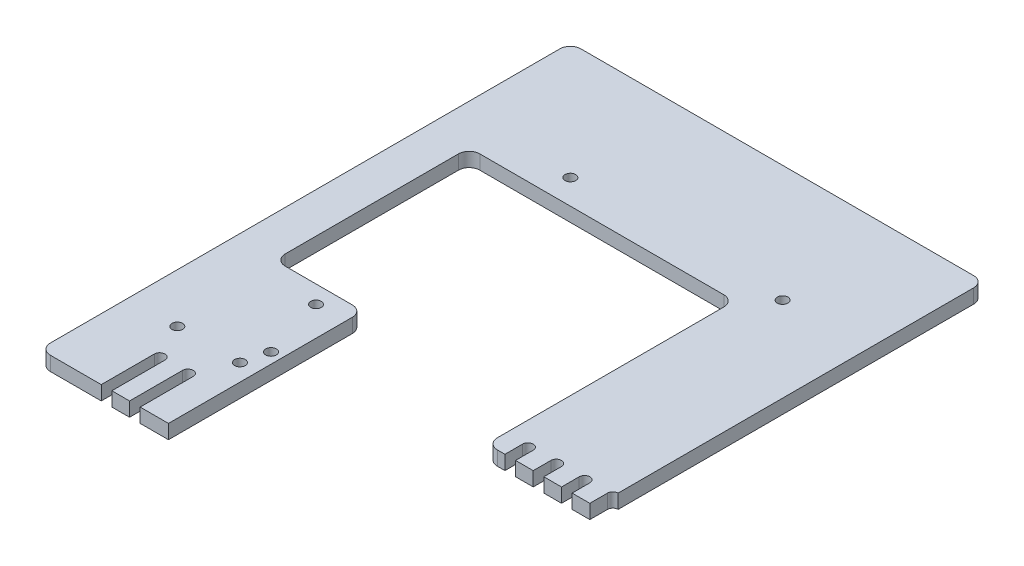
from build123d import *

# Parameters (mm, degrees)
SKETCH_1_R      = 1.5
SKETCH_1_W      = 6
SKETCH_1_H      = 6
EXTRUDE_1_DEPTH = 4
FILLET_1_R      = 3


with BuildPart() as part:
    # 草图1 → 凸台-拉伸1 (new body)
    # profile 1 of 4: a face of its own
    with BuildSketch(Plane(origin=(0, 0, 0), x_dir=(1, 0, 0), z_dir=(0, 1, 0))):
        Polygon((-116.482347914, -142.242252719), (-105.097347914, -142.242252719), (-105.097347914, -87.242252719), (-105.097347914, -32.242252719), (-30.097347914, -32.242252719), (-30.097347914, -87.242252719), (0.517652086, -87.242252719), (0.517652086, 7.757747281), (-116.482347914, 7.757747281), align=None)
        with Locations(Location((-83.482347914, -25.242252719, 0), (0, 0, 270))):
            Circle(SKETCH_1_R, mode=Mode.SUBTRACT)
        with Locations(Location((-23.482347914, -25.242252719, 0), (0, 0, 270))):
            Circle(SKETCH_1_R, mode=Mode.SUBTRACT)
    # profile 2 of 4: a face of its own
    with BuildSketch(Plane(origin=(0, 0, 0), x_dir=(1, 0, 0), z_dir=(0, 1, 0))):
        with BuildLine():
            Line((0.517652086, -87.242252719), (-30.097347914, -87.242252719))
            Line((-30.097347914, -87.242252719), (-30.097347914, -102.242252719))
            Line((-30.097347914, -102.242252719), (-24.982347914, -102.242252719))
            Line((-24.982347914, -102.242252719), (-24.982347914, -97.242252719))
            ThreePointArc((-24.982347914, -97.242252719), (-23.482347914, -95.742252719), (-21.982347914, -97.242252719))
            Line((-21.982347914, -97.242252719), (-21.982347914, -102.242252719))
            Line((-21.982347914, -102.242252719), (-16.982347914, -102.242252719))
            Line((-16.982347914, -102.242252719), (-16.982347914, -97.242252719))
            ThreePointArc((-16.982347914, -97.242252719), (-15.482347914, -95.742252719), (-13.982347914, -97.242252719))
            Line((-13.982347914, -97.242252719), (-13.982347914, -102.242252719))
            Line((-13.982347914, -102.242252719), (-8.982347914, -102.242252719))
            Line((-8.982347914, -102.242252719), (-8.982347914, -97.242252719))
            ThreePointArc((-8.982347914, -97.242252719), (-7.482347914, -95.742252719), (-5.982347914, -97.242252719))
            Line((-5.982347914, -97.242252719), (-5.982347914, -102.242252719))
            Line((-5.982347914, -102.242252719), (-0.982347914, -102.242252719))
            Line((-0.982347914, -102.242252719), (-0.982347914, -97.242252719))
            ThreePointArc((-0.982347914, -97.242252719), (-0.543008086, -96.181592547), (0.517652086, -95.742252719))
            Line((0.517652086, -95.742252719), (0.517652086, -87.242252719))
        make_face()
    # profile 3 of 4: a face of its own
    with BuildSketch(Plane(origin=(0, 0, 0), x_dir=(1, 0, 0), z_dir=(0, 1, 0))):
        with BuildLine():
            Line((-88.097347914, -142.242252719), (-80.097347914, -142.242252719))
            Line((-80.097347914, -142.242252719), (-80.097347914, -113.742252719))
            Line((-80.097347914, -113.742252719), (-80.097347914, -113.242252719))
            Line((-80.097347914, -113.242252719), (-86.097347914, -113.242252719))
            Line((-86.097347914, -113.242252719), (-86.097347914, -107.242252719))
            Line((-86.097347914, -107.242252719), (-80.097347914, -107.242252719))
            Line((-80.097347914, -107.242252719), (-80.097347914, -87.242252719))
            Line((-80.097347914, -87.242252719), (-105.097347914, -87.242252719))
            Line((-105.097347914, -87.242252719), (-105.097347914, -142.242252719))
            Line((-105.097347914, -142.242252719), (-99.097347914, -142.242252719))
            Line((-99.097347914, -142.242252719), (-99.097347914, -127.242252719))
            ThreePointArc((-99.097347914, -127.242252719), (-97.597347914, -125.742252719), (-96.097347914, -127.242252719))
            Line((-96.097347914, -127.242252719), (-96.097347914, -142.242252719))
            Line((-96.097347914, -142.242252719), (-91.097347914, -142.242252719))
            Line((-91.097347914, -142.242252719), (-91.097347914, -127.242252719))
            ThreePointArc((-91.097347914, -127.242252719), (-89.597347914, -125.742252719), (-88.097347914, -127.242252719))
            Line((-88.097347914, -127.242252719), (-88.097347914, -142.242252719))
        make_face()
        with Locations(Location((-102.597347914, -117.242252719, 0), (0, 0, 270))):
            Circle(SKETCH_1_R, mode=Mode.SUBTRACT)
        with Locations(Location((-84.897347914, -117.242252719, 0), (0, 0, 270))):
            Circle(SKETCH_1_R, mode=Mode.SUBTRACT)
        with Locations(Location((-88.387347914, -92.242252719, 0), (0, 0, 270))):
            Circle(SKETCH_1_R, mode=Mode.SUBTRACT)
    # profile 4 of 4: a face of its own
    with BuildSketch(Plane(origin=(0, 0, 0), x_dir=(1, 0, 0), z_dir=(0, 1, 0))):
        with Locations((-83.097347914, -110.242252719)):
            Rectangle(SKETCH_1_W, SKETCH_1_H)
        with Locations(Location((-83.097347914, -110.242252719, 0), (0, 0, 270))):
            Circle(SKETCH_1_R, mode=Mode.SUBTRACT)
    extrude(amount=EXTRUDE_1_DEPTH)

    # 圆角1
    fillet_1_edges = [part.edges().sort_by_distance(p)[0] for p in [
        (-30.097347914, 2, 102.242252719),
        (-30.097347914, 2, 32.242252719),
        (-105.097347914, 2, 32.242252719),
        (-105.097347914, 2, 87.242252719),
        (-80.097347914, 2, 87.242252719),
        (-116.482347914, 2, 142.242252719),
        (-116.482347914, 2, -7.757747281),
        (0.517652086, 2, -7.757747281),
    ]]
    fillet(fillet_1_edges, radius=FILLET_1_R)


solid = part.part
